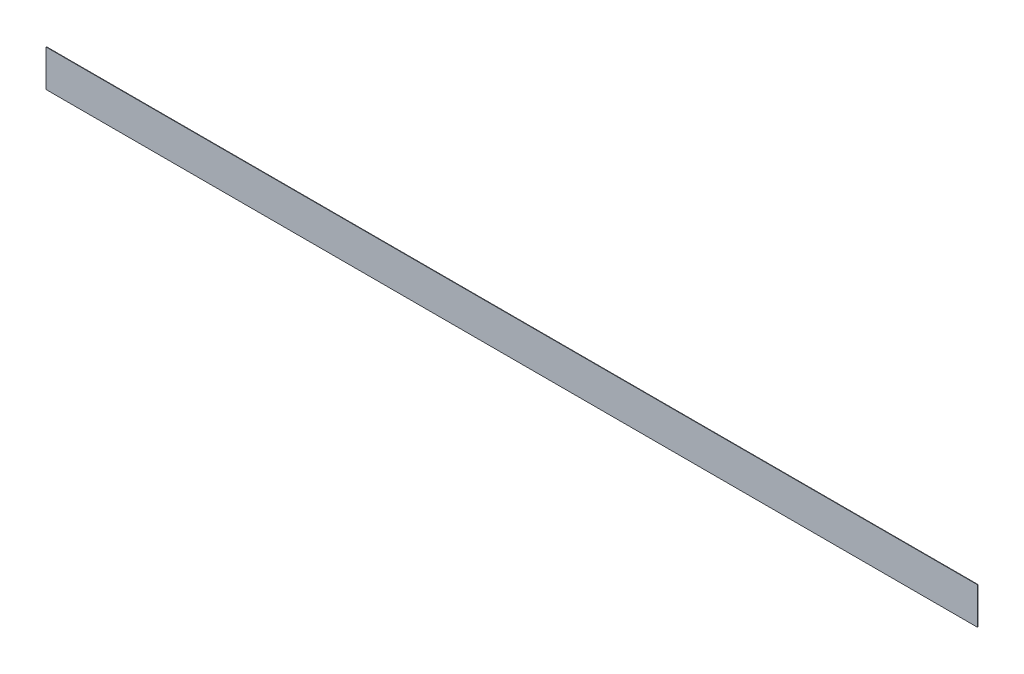
from build123d import *

# Parameters (mm, degrees)
SKETCH1_W           = 336.55
SKETCH1_H           = 482.6
BOSS_EXTRUDE1_DEPTH = 6.35


with BuildPart() as part:
    # Sketch1 → Boss-Extrude1 (new body)
    with BuildSketch(Plane.XY):
        with Locations((-168.275, 241.3)):
            Rectangle(SKETCH1_W, SKETCH1_H)
        Polygon((-12838.10615, 0), (-336.55, 0), (-336.55, 482.6), (0, 482.6), (0, 508), (-12838.10615, 508), align=None)
    extrude(amount=-BOSS_EXTRUDE1_DEPTH)


solid = part.part
